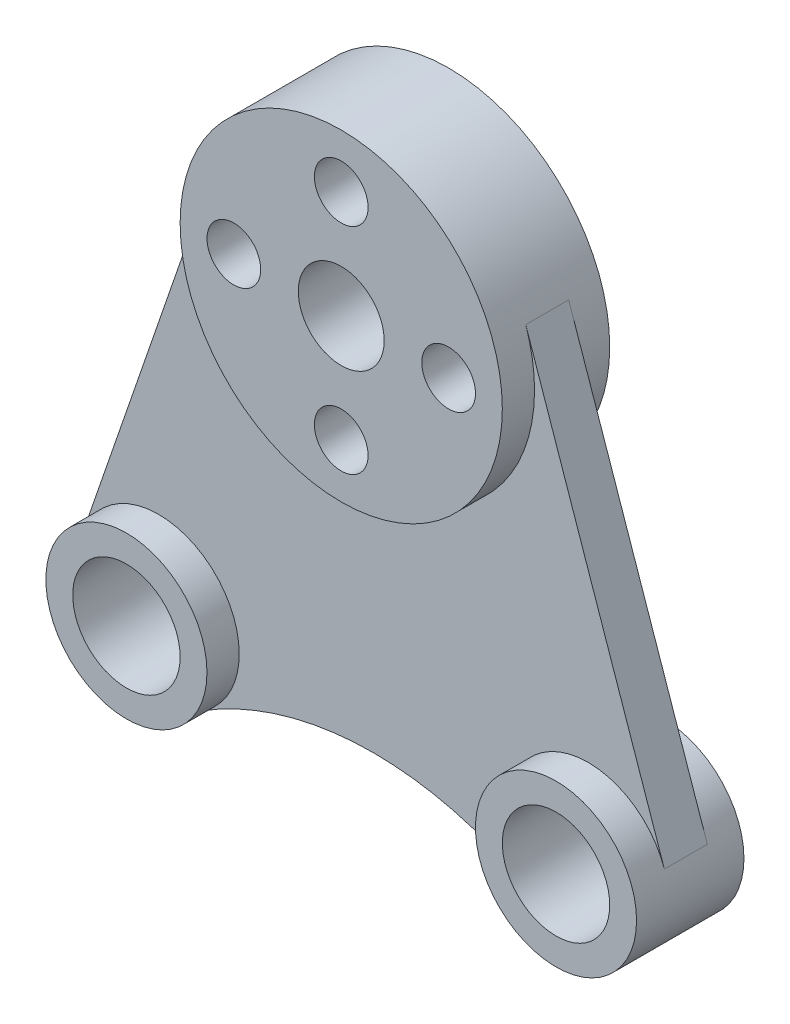
from build123d import *

# Parameters (mm, degrees)
SKETCH1_R             = 30
SKETCH1_R_2           = 8
SKETCH1_R_3           = 5
BOSS_EXTRUDE1_DEPTH   = 10
SKETCH1_R_4           = 15
SKETCH1_R_5           = 10
BOSS_EXTRUDE1_2_DEPTH = 10
BOSS_EXTRUDE1_3_DEPTH = 10
BOSS_EXTRUDE2_DEPTH   = 4


with BuildPart() as part:
    # Sketch1 → Boss-Extrude1 (new, symmetric)
    with BuildSketch(Plane.XY):
        Circle(SKETCH1_R)
        Circle(SKETCH1_R_2, mode=Mode.SUBTRACT)
        with Locations((20, 0)):
            Circle(SKETCH1_R_3, mode=Mode.SUBTRACT)
        with Locations((0, -20)):
            Circle(SKETCH1_R_3, mode=Mode.SUBTRACT)
        with Locations((-20, 0)):
            Circle(SKETCH1_R_3, mode=Mode.SUBTRACT)
        with Locations((0, 20)):
            Circle(SKETCH1_R_3, mode=Mode.SUBTRACT)
    extrude(amount=BOSS_EXTRUDE1_DEPTH, both=True)



with BuildPart() as body_2:
    # Sketch1 → Boss-Extrude1 2 (new, symmetric)
    with BuildSketch(Plane.XY):
        with Locations((40, -70)):
            Circle(SKETCH1_R_4)
        with Locations((40, -70)):
            Circle(SKETCH1_R_5, mode=Mode.SUBTRACT)
    extrude(amount=BOSS_EXTRUDE1_2_DEPTH, both=True)


with BuildPart() as body_3:
    # Sketch1 → Boss-Extrude1 3 (new, symmetric)
    with BuildSketch(Plane.XY):
        with Locations((-40, -70)):
            Circle(SKETCH1_R_4)
        with Locations((-40, -70)):
            Circle(SKETCH1_R_5, mode=Mode.SUBTRACT)
    extrude(amount=BOSS_EXTRUDE1_3_DEPTH, both=True)


with BuildPart() as part_1:
    add(part.part)

    add(body_2.part)  # Boss-Extrude2 merges body 2

    add(body_3.part)  # Boss-Extrude2 merges body 3
    # Sketch1<3> → Boss-Extrude2 (add, symmetric)
    with BuildSketch(Plane.XY):
        with BuildLine():
            Line((54.180868072, -65.11093253), (28.361736144, 9.778134939))
            ThreePointArc((28.361736144, 9.778134939), (29.587599466, 4.957212709), (30, 0))
            ThreePointArc((30, 0), (-4.957212709, -29.587599466), (-28.361736144, 9.778134939))
            Line((-28.361736144, 9.778134939), (-54.180868072, -65.11093253))
            ThreePointArc((-54.180868072, -65.11093253), (-37.521393646, -55.206200267), (-25, -70))
            ThreePointArc((-25, -70), (-26.866074463, -77.245688373), (-32, -82.68857754))
            ThreePointArc((-32, -82.68857754), (0, -73.442887702), (32, -82.68857754))
            ThreePointArc((32, -82.68857754), (30.683660399, -58.24390301), (54.180868072, -65.11093253))
        make_face()
    extrude(amount=BOSS_EXTRUDE2_DEPTH, both=True)


solid = part_1.part
